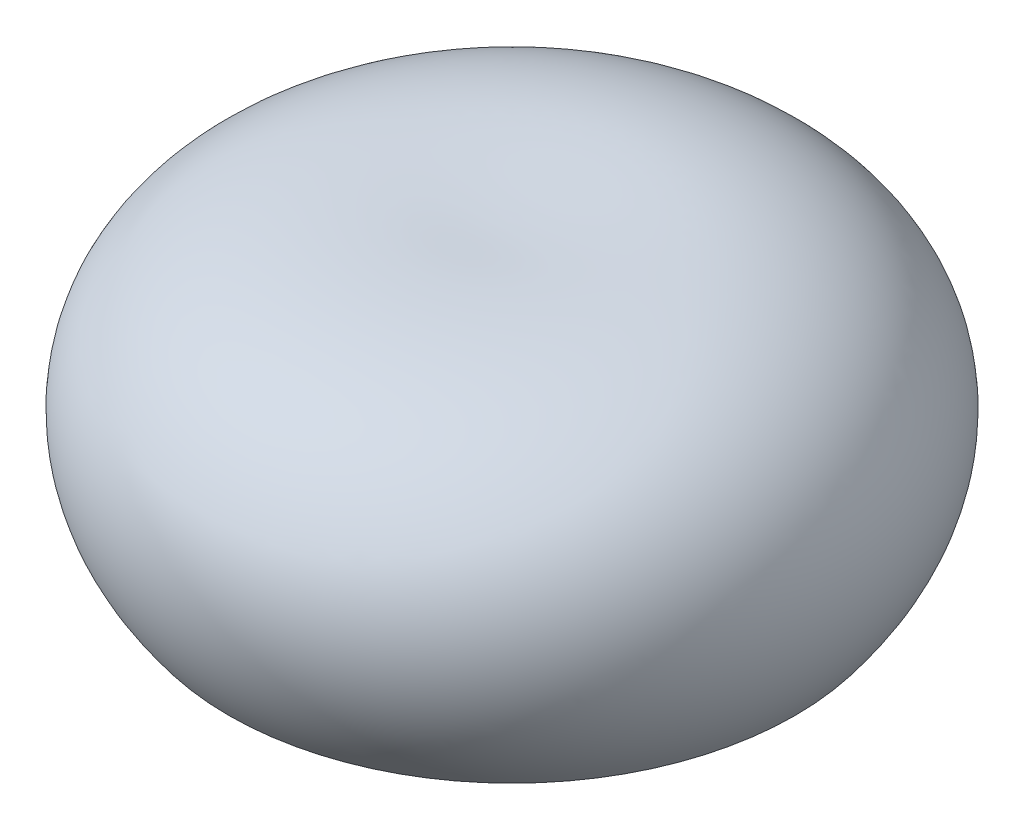
from build123d import *


with BuildPart() as part:
    # 草图1 → 旋转1 (revolve)
    with BuildSketch(Plane.XY):
        with BuildLine():
            Line((0, 7), (0, 0))
            Line((0, 0), (6.831441261, 0))
            add(Edge.make_bspline(
                [(0, 7), (0.073826027, 6.99961248), (0.178309524, 6.999064037), (0.306353289, 7.001245912), (0.380494798, 7.002863842), (0.441570297, 7.004497041), (0.495006805, 7.006121221), (0.543211062, 7.007739734), (0.587527277, 7.009349058), (0.628802834, 7.010947825), (0.667614606, 7.012534752), (0.704377034, 7.01410898), (0.739400045, 7.015669846), (0.772922733, 7.017216861), (0.805134201, 7.018749647), (0.83618711, 7.020267916), (0.866206819, 7.021771443), (0.895297775, 7.023260054), (0.923548095, 7.024733613), (0.951032931, 7.026192009), (0.977816991, 7.027635168), (1.003956462, 7.029063019), (1.029500501, 7.030475521), (1.054492406, 7.031872635), (1.078970545, 7.033254337), (1.10296911, 7.034620614), (1.126518722, 7.035971457), (1.149646932, 7.037306863), (1.172378634, 7.038626836), (1.194736407, 7.039931383), (1.216740809, 7.041220517), (1.238410615, 7.042494251), (1.25976303, 7.0437526), (1.280813862, 7.044995589), (1.301577678, 7.046223234), (1.322067936, 7.047435562), (1.342297094, 7.048632594), (1.362276717, 7.049814357), (1.382017559, 7.050980881), (1.401529643, 7.052132189), (1.420822325, 7.053268312), (1.439904357, 7.054389279), (1.458783938, 7.055495119), (1.477468763, 7.056585861), (1.495966064, 7.057661539), (1.514282646, 7.058722181), (1.532424926, 7.059767819), (1.550398957, 7.060798482), (1.568210462, 7.061814207), (1.585864853, 7.062815017), (1.603367259, 7.063800952), (1.62072254, 7.064772037), (1.637935314, 7.065728308), (1.655009966, 7.066669794), (1.671950667, 7.067596524), (1.68876139, 7.068508536), (1.705445919, 7.069405855), (1.722007866, 7.070288514), (1.738450677, 7.071156547), (1.754777643, 7.072009978), (1.770991912, 7.072848845), (1.787096497, 7.073673172), (1.803094282, 7.074482995), (1.81898803, 7.075278339), (1.834780391, 7.076059237), (1.850473907, 7.076825718), (1.86607102, 7.077577811), (1.881574075, 7.078315544), (1.896985327, 7.079038948), (1.912306943, 7.07974805), (1.927541011, 7.080442881), (1.94268954, 7.081123467), (1.957754466, 7.081789835), (1.972737654, 7.082442017), (1.987640906, 7.083080038), (2.002465956, 7.083703922), (2.017214482, 7.084313704), (2.031888102, 7.084909403), (2.046488381, 7.085491048), (2.06101683, 7.086058669), (2.075474911, 7.086612287), (2.089864039, 7.087151929), (2.104185584, 7.087677622), (2.118440871, 7.088189393), (2.132631183, 7.088687262), (2.146757765, 7.089171256), (2.160821822, 7.089641403), (2.174824525, 7.090097722), (2.188767006, 7.09054024), (2.202650367, 7.09096898), (2.216475676, 7.091383966), (2.23024397, 7.091785222), (2.243956256, 7.092172768), (2.257613513, 7.092546632), (2.271216693, 7.092906831), (2.284766719, 7.093253391), (2.298264492, 7.093586334), (2.311710885, 7.09390568), (2.32510675, 7.094211452), (2.338452915, 7.094503671), (2.351750186, 7.094782357), (2.364999348, 7.095047533), (2.378201166, 7.09529922), (2.391356385, 7.095537436), (2.404465731, 7.095762203), (2.417529911, 7.09597354), (2.430549615, 7.096171469), (2.443525516, 7.096356007), (2.45645827, 7.096527175), (2.469348518, 7.09668499), (2.482196883, 7.096829475), (2.495003975, 7.096960644), (2.50777039, 7.097078519), (2.520496708, 7.097183115), (2.533183498, 7.097274453), (2.545831313, 7.097352551), (2.558440695, 7.097417424), (2.571012173, 7.097469092), (2.583546264, 7.09750757), (2.596043474, 7.097532877), (2.608504298, 7.097545029), (2.620929218, 7.097544042), (2.633318709, 7.097529932), (2.64567323, 7.097502718), (2.657993237, 7.097462414), (2.67027917, 7.097409035), (2.682531464, 7.097342598), (2.694750544, 7.09726312), (2.706936823, 7.097170612), (2.719090708, 7.097065093), (2.731212598, 7.096946574), (2.743302883, 7.096815074), (2.755361945, 7.096670604), (2.767390158, 7.096513182), (2.779387888, 7.096342817), (2.791355496, 7.096159528), (2.803293333, 7.095963325), (2.815201745, 7.095754224), (2.827081071, 7.095532236), (2.838931641, 7.095297379), (2.850753782, 7.095049659), (2.862547814, 7.094789094), (2.874314048, 7.094515696), (2.886052794, 7.094229477), (2.89776435, 7.093930449), (2.909449014, 7.093618625), (2.921107076, 7.093294014), (2.932738821, 7.092956632), (2.944344528, 7.092606489), (2.955924471, 7.092243596), (2.967478921, 7.091867965), (2.979008141, 7.091479607), (2.990512392, 7.091078535), (3.001991929, 7.090664754), (3.013447002, 7.090238283), (3.024877857, 7.089799124), (3.036284736, 7.089347295), (3.047667878, 7.088882802), (3.059027515, 7.088405656), (3.070363877, 7.087915865), (3.081677189, 7.087413443), (3.092967672, 7.086898398), (3.104235546, 7.086370736), (3.115481023, 7.085830472), (3.126704315, 7.085277611), (3.137905628, 7.084712164), (3.149085165, 7.084134138), (3.160243127, 7.083543545), (3.171379711, 7.08294039), (3.18249511, 7.082324685), (3.193589514, 7.081696437), (3.204663111, 7.081055651), (3.215716085, 7.080402341), (3.226748617, 7.079736509), (3.237760886, 7.079058168), (3.248753066, 7.078367321), (3.25972533, 7.077663979), (3.270677849, 7.076948147), (3.28161079, 7.076219835), (3.292524317, 7.075479047), (3.303418592, 7.074725791), (3.314293774, 7.073960076), (3.325150021, 7.073181906), (3.335987487, 7.072391289), (3.346806324, 7.071588229), (3.357606682, 7.070772736), (3.368388709, 7.069944815), (3.379152549, 7.069104471), (3.389898346, 7.068251711), (3.40062624, 7.067386539), (3.411336371, 7.066508962), (3.422028874, 7.065618987), (3.432703885, 7.064716619), (3.443361536, 7.063801859), (3.454001959, 7.062874719), (3.46462528, 7.061935199), (3.475231627, 7.060983306), (3.485821126, 7.060019045), (3.496393899, 7.059042419), (3.506950067, 7.058053435), (3.51748975, 7.057052097), (3.528013066, 7.056038409), (3.53852013, 7.055012375), (3.549011057, 7.053973998), (3.559485961, 7.052923283), (3.569944951, 7.051860236), (3.580388137, 7.050784859), (3.590815628, 7.049697155), (3.60122753, 7.04859713), (3.611623946, 7.047484783), (3.622004982, 7.046360123), (3.632370739, 7.04522315), (3.642721317, 7.044073867), (3.653056816, 7.042912278), (3.663377333, 7.041738386), (3.673682964, 7.040552194), (3.683973805, 7.039353704), (3.694249949, 7.038142919), (3.704511488, 7.036919842), (3.714758514, 7.035684475), (3.724991116, 7.03443682), (3.735209383, 7.033176878), (3.745413403, 7.031904655), (3.75560326, 7.03062015), (3.765779041, 7.029323364), (3.775940829, 7.028014301), (3.786088707, 7.026692964), (3.796222756, 7.025359352), (3.806343057, 7.024013466), (3.816449688, 7.02265531), (3.826542729, 7.021284883), (3.836622256, 7.019902188), (3.846688346, 7.018507226), (3.856741073, 7.017099995), (3.866780512, 7.015680502), (3.876806735, 7.01424874), (3.886819815, 7.012804716), (3.896819824, 7.01134843), (3.90680683, 7.009879879), (3.916780903, 7.008399066), (3.926742113, 7.006905992), (3.936690524, 7.005400655), (3.946626205, 7.003883057), (3.956549222, 7.002353198), (3.966459637, 7.000811077), (3.976357517, 6.999256695), (3.986242922, 6.997690051), (3.996115917, 6.996111144), (4.005976561, 6.994519976), (4.015824916, 6.992916545), (4.02566104, 6.991300851), (4.035484994, 6.989672893), (4.045296834, 6.988032669), (4.055096619, 6.986380181), (4.064884405, 6.984715427), (4.074660248, 6.983038404), (4.084424202, 6.981349114), (4.094176323, 6.979647555), (4.103916663, 6.977933724), (4.113645276, 6.976207622), (4.123362214, 6.974469247), (4.133067528, 6.972718596), (4.142761269, 6.970955668), (4.152443487, 6.969180463), (4.162114232, 6.967392978), (4.171773552, 6.965593212), (4.181421496, 6.963781161), (4.191058111, 6.961956825), (4.200683444, 6.960120203), (4.210297541, 6.958271289), (4.219900448, 6.956410085), (4.229492209, 6.954536586), (4.239072869, 6.95265079), (4.248642473, 6.950752695), (4.258201062, 6.948842299), (4.267748681, 6.946919598), (4.277285369, 6.94498459), (4.286811171, 6.943037272), (4.296326125, 6.941077643), (4.305830272, 6.939105696), (4.315323653, 6.937121433), (4.324806306, 6.935124847), (4.334278271, 6.933115936), (4.343739584, 6.931094697), (4.353190285, 6.929061127), (4.36263041, 6.927015222), (4.372059995, 6.924956978), (4.381479078, 6.922886393), (4.390887692, 6.920803462), (4.400285874, 6.918708182), (4.409673658, 6.916600549), (4.419051079, 6.914480559), (4.42841817, 6.912348208), (4.437774964, 6.910203491), (4.447121494, 6.908046408), (4.456457791, 6.905876949), (4.465783889, 6.903695116), (4.475099817, 6.901500898), (4.484405608, 6.899294297), (4.493701291, 6.897075303), (4.502986897, 6.894843915), (4.512262455, 6.892600126), (4.521527995, 6.890343936), (4.530783544, 6.888075334), (4.540029131, 6.885794319), (4.549264784, 6.883500886), (4.55849053, 6.881195028), (4.567706398, 6.878876743), (4.576912412, 6.876546022), (4.5861086, 6.874202864), (4.595294987, 6.871847261), (4.604471599, 6.869479209), (4.61363846, 6.8670987), (4.622795596, 6.864705731), (4.63194303, 6.862300299), (4.641080787, 6.859882391), (4.65020889, 6.85745201), (4.659327362, 6.855009142), (4.668436227, 6.852553788), (4.677535505, 6.850085939), (4.686625221, 6.847605588), (4.695705394, 6.845112732), (4.704776047, 6.842607362), (4.713837201, 6.840089474), (4.722888876, 6.83755906), (4.731931092, 6.835016114), (4.740963871, 6.832460632), (4.74998723, 6.829892604), (4.75900119, 6.827312027), (4.768005769, 6.824718891), (4.777000986, 6.822113193), (4.785986859, 6.819494921), (4.794963407, 6.816864075), (4.803930647, 6.814220643), (4.812888596, 6.811564621), (4.821837272, 6.808895998), (4.830776691, 6.806214774), (4.839706869, 6.803520935), (4.848627822, 6.800814476), (4.857539568, 6.798095391), (4.866442119, 6.795363672), (4.875335493, 6.792619313), (4.884219704, 6.789862302), (4.893094767, 6.787092637), (4.901960695, 6.784310306), (4.910817504, 6.781515306), (4.919665205, 6.778707625), (4.928503814, 6.775887257), (4.937333343, 6.773054194), (4.946153805, 6.770208428), (4.954965213, 6.767349953), (4.963767579, 6.764478756), (4.972560915, 6.761594835), (4.981345232, 6.758698176), (4.990120543, 6.755788775), (4.998886858, 6.752866623), (5.007644188, 6.74993171), (5.016392546, 6.746984029), (5.025131939, 6.744023569), (5.033862379, 6.741050326), (5.042583876, 6.738064287), (5.051296439, 6.735065448), (5.060000077, 6.732053794), (5.068694801, 6.729029321), (5.077380618, 6.725992018), (5.086057538, 6.722941878), (5.094725569, 6.71987889), (5.103384718, 6.716803044), (5.112034995, 6.713714334), (5.120676405, 6.710612749), (5.129308958, 6.70749828), (5.137932659, 6.704370916), (5.146547516, 6.701230651), (5.155153537, 6.698077474), (5.163750726, 6.694911373), (5.17233909, 6.691732342), (5.180918636, 6.688540369), (5.189489369, 6.685335446), (5.198051295, 6.682117563), (5.206604418, 6.678886708), (5.215148744, 6.675642873), (5.223684278, 6.672386047), (5.232211025, 6.669116222), (5.240728988, 6.665833385), (5.249238171, 6.662537528), (5.25773858, 6.659228639), (5.266230218, 6.65590671), (5.274713087, 6.652571728), (5.283187193, 6.649223684), (5.291652536, 6.645862568), (5.300109121, 6.642488368), (5.308556949, 6.639101074), (5.316996024, 6.635700677), (5.325426348, 6.632287163), (5.333847922, 6.628860523), (5.342260749, 6.625420747), (5.350664829, 6.62196782), (5.359060165, 6.618501737), (5.367446757, 6.615022483), (5.375824607, 6.611530048), (5.384193715, 6.608024418), (5.392554082, 6.604505586), (5.400905709, 6.60097354), (5.409248594, 6.597428265), (5.417582739, 6.593869754), (5.425908142, 6.590297991), (5.434224804, 6.586712969), (5.442532724, 6.583114673), (5.450831901, 6.579503092), (5.459122334, 6.575878214), (5.467404022, 6.572240029), (5.475676964, 6.568588524), (5.483941157, 6.564923686), (5.492196599, 6.561245503), (5.50044329, 6.557553965), (5.508681226, 6.553849056), (5.516910406, 6.550130769), (5.525130826, 6.546399086), (5.533342485, 6.542653999), (5.541545379, 6.538895494), (5.549739504, 6.535123557), (5.557924857, 6.531338176), (5.566101436, 6.527539342), (5.574269235, 6.523727037), (5.582428252, 6.519901252), (5.590578482, 6.516061971), (5.598719922, 6.512209184), (5.606852565, 6.508342875), (5.61497641, 6.504463035), (5.623091449, 6.500569647), (5.631197678, 6.496662699), (5.639295091, 6.492742179), (5.647383684, 6.488808072), (5.655463452, 6.484860367), (5.663534387, 6.480899047), (5.671596486, 6.476924101), (5.679649739, 6.472935514), (5.687694144, 6.468933274), (5.695729692, 6.464917367), (5.703756377, 6.460887777), (5.711774192, 6.456844492), (5.71978313, 6.452787497), (5.727783185, 6.44871678), (5.735774348, 6.444632324), (5.743756613, 6.440534118), (5.751729971, 6.436422145), (5.759694415, 6.432296392), (5.767649937, 6.428156845), (5.775596528, 6.424003489), (5.783534181, 6.41983631), (5.791462886, 6.415655292), (5.799382636, 6.411460423), (5.807293419, 6.407251684), (5.81519523, 6.403029064), (5.823088058, 6.398792549), (5.830971892, 6.394542118), (5.838846725, 6.390277764), (5.846712546, 6.385999466), (5.854569345, 6.381707212), (5.862417112, 6.377400984), (5.870255837, 6.37308077), (5.878085509, 6.368746552), (5.885906118, 6.364398316), (5.893717654, 6.360036046), (5.901520105, 6.355659726), (5.90931346, 6.351269342), (5.917097708, 6.346864875), (5.924872839, 6.342446315), (5.932638837, 6.338013638), (5.940395695, 6.333566835), (5.948143398, 6.329105888), (5.955881936, 6.324630778), (5.963611296, 6.320141494), (5.971331465, 6.315638016), (5.97904243, 6.311120327), (5.98674418, 6.306588415), (5.994436701, 6.302042259), (6.002119979, 6.297481844), (6.009794004, 6.292907155), (6.017458758, 6.288318172), (6.02511423, 6.283714882), (6.032760407, 6.279097266), (6.040397273, 6.274465306), (6.048024816, 6.269818988), (6.05564302, 6.265158293), (6.06325187, 6.260483203), (6.070851354, 6.255793703), (6.078441456, 6.251089774), (6.08602216, 6.246371399), (6.093593452, 6.241638561), (6.101155317, 6.236891242), (6.108707739, 6.232129424), (6.116250702, 6.22735309), (6.123784191, 6.222562222), (6.13130819, 6.217756803), (6.138822681, 6.212936811), (6.146327653, 6.208102235), (6.153823082, 6.203253049), (6.161308958, 6.198389242), (6.16878526, 6.19351079), (6.176251974, 6.188617678), (6.183709081, 6.183709887), (6.191156565, 6.178787397), (6.198594407, 6.173850191), (6.206022591, 6.168898249), (6.213441098, 6.163931553), (6.220849911, 6.158950084), (6.228249012, 6.153953824), (6.235638381, 6.148942751), (6.243018001, 6.143916849), (6.250387854, 6.138876098), (6.25774792, 6.133820477), (6.26509818, 6.128749968), (6.272438616, 6.123664551), (6.279769208, 6.118564209), (6.287089935, 6.113448917), (6.294400781, 6.10831866), (6.301701724, 6.103173416), (6.308992744, 6.098013165), (6.316273821, 6.092837888), (6.323544934, 6.087647564), (6.330806063, 6.082442172), (6.33805719, 6.077221696), (6.345298289, 6.071986108), (6.352529345, 6.066735396), (6.359750331, 6.061469533), (6.36696123, 6.056188501), (6.374162017, 6.050892278), (6.381352675, 6.045580846), (6.388533176, 6.040254179), (6.395703504, 6.034912262), (6.402863633, 6.029555069), (6.410013542, 6.024182581), (6.417153208, 6.018794776), (6.424282608, 6.013391631), (6.431401721, 6.007973128), (6.438510521, 6.002539242), (6.445608988, 5.997089955), (6.452697094, 5.991625239), (6.459774821, 5.98614508), (6.466842141, 5.980649449), (6.473899031, 5.975138327), (6.480945468, 5.969611692), (6.487981427, 5.964069521), (6.495006884, 5.95851179), (6.502021813, 5.95293848), (6.50902619, 5.947349564), (6.51601999, 5.941745023), (6.523003188, 5.936124831), (6.529975758, 5.930488968), (6.536937674, 5.924837409), (6.543888912, 5.91917013), (6.550829444, 5.91348711), (6.557759247, 5.907788324), (6.56467829, 5.902073748), (6.57158655, 5.896343361), (6.578483999, 5.890597136), (6.585370611, 5.884835051), (6.592246357, 5.879057081), (6.599111213, 5.873263203), (6.605965148, 5.867453391), (6.612808137, 5.861627622), (6.619640151, 5.855785872), (6.626461162, 5.849928114), (6.633271142, 5.844054327), (6.640070062, 5.838164483), (6.646857895, 5.832258559), (6.65363461, 5.826336527), (6.66040018, 5.820398366), (6.667154576, 5.814444048), (6.673897766, 5.808473547), (6.680629723, 5.802486841), (6.687350415, 5.7964839), (6.694059815, 5.790464702), (6.700757891, 5.784429218), (6.707444612, 5.778377424), (6.714119949, 5.772309292), (6.72078387, 5.766224797), (6.727436346, 5.760123913), (6.734077343, 5.754006611), (6.740706832, 5.747872867), (6.747324779, 5.741722653), (6.753931155, 5.735555942), (6.760525926, 5.729372706), (6.767109061, 5.72317292), (6.773680527, 5.716956554), (6.780240291, 5.710723583), (6.786788322, 5.704473979), (6.793324585, 5.698207711), (6.799849047, 5.691924755), (6.806361676, 5.685625081), (6.812862436, 5.679308661), (6.819351296, 5.672975467), (6.82582822, 5.66662547), (6.832293173, 5.660258641), (6.838746122, 5.653874952), (6.845187032, 5.647474375), (6.851615868, 5.641056878), (6.858032594, 5.634622434), (6.864437176, 5.628171013), (6.870829578, 5.621702586), (6.877209762, 5.615217122), (6.883577694, 5.608714591), (6.889933338, 5.602194965), (6.896276656, 5.595658212), (6.902607613, 5.589104304), (6.908926169, 5.582533207), (6.915232291, 5.575944892), (6.921525938, 5.569339329), (6.927807074, 5.562716486), (6.93407566, 5.556076332), (6.940331659, 5.549418835), (6.946575032, 5.542743965), (6.95280574, 5.536051689), (6.959023744, 5.529341976), (6.965229006, 5.522614794), (6.971421487, 5.515870111), (6.977601144, 5.509107892), (6.983767942, 5.502328109), (6.989921836, 5.495530725), (6.996062789, 5.488715709), (7.00219076, 5.481883029), (7.008305706, 5.47503265), (7.014407587, 5.468164539), (7.020496364, 5.461278663), (7.026571991, 5.454374986), (7.03263443, 5.447453477), (7.038683638, 5.440514101), (7.04471957, 5.433556822), (7.050742184, 5.426581606), (7.056751441, 5.41958842), (7.062747294, 5.412577226), (7.0687297, 5.405547991), (7.074698615, 5.398500679), (7.080653997, 5.391435254), (7.086595799, 5.384351681), (7.092523978, 5.377249924), (7.09843849, 5.370129945), (7.104339288, 5.36299171), (7.110226328, 5.355835181), (7.116099562, 5.348660321), (7.121958947, 5.341467093), (7.127804434, 5.33425546), (7.133635978, 5.327025384), (7.139453534, 5.319776829), (7.145257051, 5.312509755), (7.151046484, 5.305224124), (7.156821783, 5.297919898), (7.162582904, 5.29059704), (7.168329793, 5.283255507), (7.174062407, 5.275895265), (7.179780693, 5.268516269), (7.185484603, 5.261118484), (7.19117409, 5.253701868), (7.196849099, 5.246266381), (7.202509584, 5.238811984), (7.208155493, 5.231338634), (7.213786775, 5.223846292), (7.219403379, 5.216334916), (7.225005254, 5.208804466), (7.230592346, 5.201254898), (7.236164607, 5.193686173), (7.24172198, 5.186098246), (7.247264415, 5.178491076), (7.252791858, 5.17086462), (7.258304256, 5.163218835), (7.263801554, 5.155553678), (7.269283698, 5.147869105), (7.274750635, 5.140165073), (7.280202309, 5.132441536), (7.285638665, 5.124698453), (7.291059647, 5.116935776), (7.296465199, 5.109153462), (7.301855266, 5.101351464), (7.307229789, 5.093529737), (7.312588712, 5.085688236), (7.31793198, 5.077826914), (7.323259529, 5.069945724), (7.328571308, 5.062044622), (7.333867255, 5.054123557), (7.339147311, 5.046182484), (7.344411415, 5.038221353), (7.349659511, 5.03024012), (7.354891536, 5.022238732), (7.360107432, 5.014217142), (7.365307135, 5.006175301), (7.370490586, 4.99811316), (7.375657723, 4.990030668), (7.380808483, 4.981927776), (7.385942803, 4.973804433), (7.39106062, 4.965660587), (7.396161874, 4.957496189), (7.401246496, 4.949311186), (7.406314425, 4.941105526), (7.411365595, 4.932879156), (7.416399942, 4.924632025), (7.4214174, 4.916364079), (7.426417902, 4.908075264), (7.431401383, 4.899765528), (7.436367773, 4.891434813), (7.441317009, 4.883083068), (7.44624902, 4.874710235), (7.451163738, 4.866316261), (7.456061095, 4.85790109), (7.460941021, 4.849464663), (7.465803446, 4.841006925), (7.470648302, 4.832527819), (7.475475515, 4.824027287), (7.480285016, 4.815505271), (7.485076733, 4.806961712), (7.48985059, 4.79839655), (7.494606521, 4.789809729), (7.499344447, 4.781201186), (7.504064297, 4.772570863), (7.508765993, 4.763918695), (7.513449467, 4.755244626), (7.518114636, 4.74654859), (7.522761429, 4.737830527), (7.527389767, 4.729090373), (7.531999574, 4.720328065), (7.536590772, 4.71154354), (7.541163283, 4.702736733), (7.545717027, 4.693907579), (7.550251926, 4.685056012), (7.5547679, 4.676181967), (7.559264867, 4.667285378), (7.563742748, 4.658366177), (7.568201459, 4.649424296), (7.572640919, 4.640459668), (7.577061042, 4.631472224), (7.581461751, 4.622461894), (7.585842955, 4.613428609), (7.590204571, 4.604372298), (7.594546516, 4.595292891), (7.5988687, 4.586190314), (7.603171038, 4.577064496), (7.607453444, 4.567915364), (7.611715826, 4.558742845), (7.615958098, 4.549546864), (7.620180171, 4.540327347), (7.624381949, 4.531084217), (7.628563348, 4.521817399), (7.632724272, 4.512526815), (7.63686463, 4.503212389), (7.640984331, 4.493874042), (7.645083274, 4.484511694), (7.649161372, 4.475125267), (7.653218524, 4.465714678), (7.657254638, 4.45627985), (7.661269612, 4.446820696), (7.665263355, 4.437337138), (7.66923576, 4.427829089), (7.673186735, 4.418296467), (7.677116175, 4.408739186), (7.68102398, 4.39915716), (7.68491005, 4.389550304), (7.688774278, 4.379918528), (7.692616567, 4.370261746), (7.696436804, 4.360579866), (7.700234889, 4.350872801), (7.704010715, 4.341140458), (7.707764174, 4.331382747), (7.711495158, 4.321599574), (7.715203559, 4.311790846), (7.718889263, 4.301956468), (7.722552163, 4.292096345), (7.726192146, 4.28221038), (7.729809098, 4.272298475), (7.733402908, 4.262360534), (7.736973454, 4.252396454), (7.740520629, 4.242406139), (7.744044308, 4.232389483), (7.747544379, 4.222346387), (7.751020719, 4.212276746), (7.754473208, 4.202180455), (7.757901727, 4.19205741), (7.76130615, 4.181907501), (7.764686357, 4.171730623), (7.76804222, 4.161526665), (7.771373615, 4.151295518), (7.774680415, 4.14103707), (7.77796249, 4.130751209), (7.781219711, 4.120437819), (7.784451948, 4.110096786), (7.787659069, 4.099727995), (7.79084094, 4.089331325), (7.793997427, 4.07890666), (7.797128393, 4.068453878), (7.800233702, 4.057972858), (7.803313213, 4.047463476), (7.80636679, 4.036925609), (7.809394288, 4.02635913), (7.812395566, 4.015763911), (7.815370481, 4.005139825), (7.818318884, 3.99448674), (7.821240631, 3.983804525), (7.824135572, 3.973093046), (7.827003555, 3.962352168), (7.829844432, 3.951581755), (7.832658048, 3.940781669), (7.835444246, 3.929951769), (7.838202873, 3.919091914), (7.84093377, 3.908201962), (7.843636775, 3.897281765), (7.846311728, 3.886331179), (7.848958465, 3.875350054), (7.851576822, 3.86433824), (7.854166632, 3.853295584), (7.856727724, 3.842221932), (7.859259931, 3.831117129), (7.861763079, 3.819981015), (7.864236993, 3.808813431), (7.866681497, 3.797614214), (7.869096413, 3.7863832), (7.87148156, 3.775120223), (7.873836757, 3.763825113), (7.876161817, 3.7524977), (7.878456556, 3.74113781), (7.880720784, 3.729745269), (7.882954312, 3.718319898), (7.885156942, 3.706861517), (7.887328483, 3.695369944), (7.889468735, 3.683844992), (7.891577499, 3.672286475), (7.893654571, 3.660694203), (7.895699747, 3.649067982), (7.897712819, 3.637407617), (7.899693575, 3.625712909), (7.901641805, 3.613983657), (7.903557292, 3.602219657), (7.905439817, 3.590420703), (7.907289162, 3.578586584), (7.9091051, 3.566717086), (7.910887405, 3.554811995), (7.912635851, 3.542871091), (7.914350199, 3.530894151), (7.91603022, 3.51888095), (7.917675669, 3.506831258), (7.91928631, 3.494744842), (7.920861894, 3.482621466), (7.922402172, 3.470460891), (7.923906896, 3.458262873), (7.925375808, 3.446027165), (7.92680865, 3.433753515), (7.928205158, 3.421441669), (7.92956507, 3.409091368), (7.930888111, 3.396702347), (7.93217401, 3.38427434), (7.93342249, 3.371807076), (7.934633269, 3.359300277), (7.935806061, 3.346753663), (7.936940577, 3.33416695), (7.93803652, 3.321539846), (7.939093596, 3.308872058), (7.940111499, 3.296163285), (7.941089923, 3.283413222), (7.942028554, 3.27062156), (7.942927078, 3.257787983), (7.943785171, 3.24491217), (7.944602506, 3.231993794), (7.945378752, 3.219032525), (7.946113571, 3.206028022), (7.946806622, 3.192979944), (7.947457556, 3.179887938), (7.948066016, 3.16675165), (7.948631649, 3.153570715), (7.949154083, 3.140344763), (7.949632952, 3.12707342), (7.950067874, 3.1137563), (7.950458468, 3.100393013), (7.950804339, 3.086983161), (7.951105095, 3.073526339), (7.951360327, 3.060022132), (7.951569625, 3.046470119), (7.951732574, 3.03286987), (7.95184874, 3.019220947), (7.951917698, 3.005522904), (7.951938999, 2.991775283), (7.951912198, 2.97797762), (7.951836834, 2.964129441), (7.951712443, 2.950230261), (7.951538547, 2.936279586), (7.951314664, 2.922276911), (7.951040298, 2.908221721), (7.950714946, 2.894113489), (7.950338097, 2.879951678), (7.949909224, 2.865735739), (7.949427798, 2.851465112), (7.948893271, 2.837139222), (7.948305089, 2.822757483), (7.947662685, 2.808319297), (7.946965479, 2.79382405), (7.946212881, 2.779271115), (7.945404291, 2.764659852), (7.944539088, 2.749989604), (7.943616644, 2.7352597), (7.942636317, 2.720469453), (7.941597449, 2.705618158), (7.940499368, 2.690705095), (7.939341388, 2.675729526), (7.938122804, 2.660690694), (7.936842898, 2.645587824), (7.935500935, 2.63042012), (7.934096162, 2.615186768), (7.932627806, 2.599886933), (7.931095082, 2.584519755), (7.929497177, 2.569084356), (7.927833264, 2.553579833), (7.926102496, 2.538005257), (7.924303998, 2.522359677), (7.922436881, 2.506642114), (7.920500227, 2.490851563), (7.918493099, 2.47498699), (7.91641453, 2.459047331), (7.914263532, 2.443031495), (7.912039084, 2.426938356), (7.909740147, 2.410766757), (7.90736564, 2.394515506), (7.904914466, 2.378183376), (7.902385483, 2.361769102), (7.899777529, 2.345271379), (7.897089394, 2.328688866), (7.894319846, 2.312020174), (7.891467606, 2.295263874), (7.888531363, 2.278418489), (7.885509757, 2.261482494), (7.882401395, 2.244454315), (7.879204834, 2.227332324), (7.875918587, 2.210114836), (7.872541115, 2.192800111), (7.86907083, 2.175386346), (7.865506094, 2.157871675), (7.861845206, 2.140254165), (7.858086412, 2.122531812), (7.854227894, 2.104702538), (7.850267765, 2.086764187), (7.846204078, 2.068714521), (7.842034806, 2.050551215), (7.837757848, 2.032271854), (7.833371027, 2.013873922), (7.828872075, 1.995354807), (7.824258639, 1.976711784), (7.819528268, 1.957942018), (7.814678413, 1.93904255), (7.809706418, 1.920010292), (7.804609514, 1.900842023), (7.79938481, 1.881534374), (7.794029295, 1.862083822), (7.788539812, 1.842486682), (7.782913068, 1.822739092), (7.777145613, 1.802837003), (7.771233831, 1.782776166), (7.765173932, 1.762552117), (7.758961935, 1.742160165), (7.752593661, 1.721595371), (7.746064711, 1.70085253), (7.73937045, 1.679926154), (7.732505999, 1.658810446), (7.725466197, 1.637499277), (7.718245598, 1.61598616), (7.710838434, 1.594264216), (7.70323859, 1.572326145), (7.695439582, 1.550164183), (7.68743451, 1.527770068), (7.679216032, 1.505134986), (7.670776315, 1.482249523), (7.662106992, 1.459103603), (7.653199103, 1.435686425), (7.644043042, 1.411986383), (7.634628477, 1.387990983), (7.624944284, 1.363686743), (7.614978446, 1.33905908), (7.604717954, 1.314092184), (7.594148689, 1.28876886), (7.583255271, 1.263070361), (7.572020914, 1.236976177), (7.560427217, 1.210463798), (7.548453948, 1.18350843), (7.536078766, 1.156082653), (7.52327691, 1.128156017), (7.510020795, 1.099694549), (7.496279544, 1.070660156), (7.482018409, 1.041009885), (7.467198033, 1.010695011), (7.451773557, 0.979659882), (7.43569345, 0.947840457), (7.418898027, 0.915162416), (7.401317504, 0.88153868), (7.382869392, 0.846866107), (7.363454982, 0.811020992), (7.342954436, 0.773852795), (7.321219775, 0.735175152), (7.298064541, 0.694752576), (7.273247917, 0.652279979), (7.246449153, 0.607349576), (7.217223809, 0.559393937), (7.184922391, 0.507579711), (7.148521469, 0.450584621), (7.106203239, 0.386040398), (7.053928975, 0.3085951), (6.962588145, 0.177853211), (6.88558457, 0.073425773), (6.831441261, 0)],
                knots=[0, 0, 0, 0, 0.016508251, 0.023363574, 0.028636216, 0.033091617, 0.037025983, 0.04059109, 0.04387702, 0.046942414, 0.049827967, 0.052563282, 0.055170689, 0.057667517, 0.060067538, 0.062381906, 0.064619804, 0.066788902, 0.068895681, 0.070945675, 0.072943656, 0.07489377, 0.076799649, 0.078664492, 0.080491139, 0.082282118, 0.084039697, 0.085765916, 0.087462619, 0.08913148, 0.090774023, 0.092391639, 0.093985605, 0.095557094, 0.097107186, 0.09863688, 0.1001471, 0.101638706, 0.103112495, 0.104569211, 0.10600955, 0.107434162, 0.108843656, 0.110238603, 0.111619541, 0.112986976, 0.114341384, 0.115683217, 0.117012898, 0.118330831, 0.119637397, 0.120932958, 0.122217857, 0.123492421, 0.12475696, 0.126011769, 0.127257131, 0.128493315, 0.129720577, 0.130939162, 0.132149305, 0.13335123, 0.134545153, 0.13573128, 0.136909808, 0.138080926, 0.139244818, 0.140401657, 0.141551613, 0.142694847, 0.143831516, 0.144961768, 0.14608575, 0.1472036, 0.148315453, 0.14942144, 0.150521684, 0.151616309, 0.15270543, 0.153789161, 0.154867612, 0.155940888, 0.157009093, 0.158072325, 0.159130682, 0.160184256, 0.161233138, 0.162277417, 0.163317176, 0.1643525, 0.165383468, 0.166410158, 0.167432647, 0.168451008, 0.169465312, 0.17047563, 0.17148203, 0.172484577, 0.173483335, 0.174478368, 0.175469736, 0.176457499, 0.177441714, 0.178422438, 0.179399726, 0.180373632, 0.181344207, 0.182311504, 0.183275571, 0.184236458, 0.185194213, 0.18614888, 0.187100506, 0.188049136, 0.188994811, 0.189937576, 0.19087747, 0.191814535, 0.192748809, 0.193680333, 0.194609143, 0.195535276, 0.19645877, 0.197379659, 0.198297978, 0.199213761, 0.200127042, 0.201037853, 0.201946226, 0.202852193, 0.203755784, 0.204657029, 0.205555959, 0.206452602, 0.207346986, 0.208239139, 0.209129089, 0.210016863, 0.210902486, 0.211785985, 0.212667385, 0.213546711, 0.214423987, 0.215299238, 0.216172487, 0.217043757, 0.217913071, 0.218780451, 0.219645919, 0.220509497, 0.221371207, 0.222231068, 0.223089102, 0.223945328, 0.224799767, 0.225652438, 0.22650336, 0.227352552, 0.228200033, 0.22904582, 0.229889932, 0.230732387, 0.231573202, 0.232412394, 0.23324998, 0.234085976, 0.234920399, 0.235753266, 0.236584591, 0.237414391, 0.23824268, 0.239069475, 0.23989479, 0.240718639, 0.241541037, 0.242361999, 0.243181539, 0.24399967, 0.244816406, 0.245631761, 0.246445748, 0.247258379, 0.248069669, 0.248879629, 0.249688273, 0.250495612, 0.251301659, 0.252106427, 0.252909926, 0.253712168, 0.254513166, 0.255312931, 0.256111473, 0.256908805, 0.257704937, 0.25849988, 0.259293644, 0.260086241, 0.26087768, 0.261667972, 0.262457128, 0.263245156, 0.264032068, 0.264817873, 0.265602581, 0.266386201, 0.267168742, 0.267950215, 0.268730627, 0.26950999, 0.27028831, 0.271065598, 0.271841862, 0.272617111, 0.273391353, 0.274164597, 0.274936852, 0.275708125, 0.276478425, 0.277247759, 0.278016137, 0.278783566, 0.279550053, 0.280315607, 0.281080235, 0.281843945, 0.282606744, 0.283368639, 0.284129639, 0.28488975, 0.28564898, 0.286407335, 0.287164823, 0.287921451, 0.288677225, 0.289432153, 0.290186241, 0.290939495, 0.291691923, 0.292443531, 0.293194325, 0.293944313, 0.294693499, 0.295441891, 0.296189495, 0.296936317, 0.297682363, 0.298427639, 0.29917215, 0.299915904, 0.300658906, 0.301401162, 0.302142677, 0.302883457, 0.303623508, 0.304362835, 0.305101445, 0.305839342, 0.306576532, 0.30731302, 0.308048812, 0.308783913, 0.309518328, 0.310252063, 0.310985123, 0.311717512, 0.312449236, 0.3131803, 0.313910709, 0.314640467, 0.31536958, 0.316098053, 0.316825891, 0.317553097, 0.318279677, 0.319005636, 0.319730978, 0.320455708, 0.321179831, 0.32190335, 0.322626271, 0.323348598, 0.324070336, 0.324791488, 0.32551206, 0.326232055, 0.326951478, 0.327670332, 0.328388624, 0.329106355, 0.329823532, 0.330540157, 0.331256236, 0.331971771, 0.332686767, 0.333401229, 0.334115159, 0.334828562, 0.335541443, 0.336253804, 0.33696565, 0.337676984, 0.338387811, 0.339098134, 0.339807957, 0.340517283, 0.341226117, 0.341934462, 0.342642321, 0.343349699, 0.344056599, 0.344763024, 0.345468979, 0.346174466, 0.346879489, 0.347584052, 0.348288158, 0.34899181, 0.349695012, 0.350397768, 0.351100081, 0.351801953, 0.352503389, 0.353204392, 0.353904965, 0.354605111, 0.355304834, 0.356004137, 0.356703023, 0.357401495, 0.358099556, 0.35879721, 0.35949446, 0.360191309, 0.360887759, 0.361583815, 0.362279479, 0.362974754, 0.363669643, 0.36436415, 0.365058277, 0.365752027, 0.366445403, 0.367138409, 0.367831047, 0.36852332, 0.369215231, 0.369906783, 0.370597978, 0.37128882, 0.371979312, 0.372669456, 0.373359255, 0.374048713, 0.374737831, 0.375426612, 0.37611506, 0.376803177, 0.377490966, 0.37817843, 0.378865571, 0.379552391, 0.380238895, 0.380925084, 0.381610961, 0.382296529, 0.38298179, 0.383666747, 0.384351403, 0.385035761, 0.385719822, 0.386403589, 0.387087066, 0.387770254, 0.388453157, 0.389135776, 0.389818115, 0.390500176, 0.391181961, 0.391863473, 0.392544714, 0.393225687, 0.393906395, 0.39458684, 0.395267024, 0.39594695, 0.39662662, 0.397306037, 0.397985203, 0.398664121, 0.399342793, 0.400021221, 0.400699408, 0.401377357, 0.402055069, 0.402732547, 0.403409794, 0.404086811, 0.404763602, 0.405440168, 0.406116513, 0.406792637, 0.407468544, 0.408144236, 0.408819716, 0.409494985, 0.410170046, 0.410844901, 0.411519553, 0.412194003, 0.412868255, 0.41354231, 0.414216171, 0.41488984, 0.415563319, 0.416236611, 0.416909718, 0.417582642, 0.418255385, 0.41892795, 0.419600339, 0.420272553, 0.420944597, 0.42161647, 0.422288177, 0.422959719, 0.423631098, 0.424302316, 0.424973377, 0.425644281, 0.426315032, 0.426985631, 0.42765608, 0.428326383, 0.42899654, 0.429666555, 0.430336429, 0.431006165, 0.431675764, 0.43234523, 0.433014564, 0.433683769, 0.434352845, 0.435021797, 0.435690626, 0.436359334, 0.437027923, 0.437696396, 0.438364755, 0.439033001, 0.439701138, 0.440369167, 0.44103709, 0.44170491, 0.442372628, 0.443040248, 0.443707771, 0.444375199, 0.445042534, 0.445709779, 0.446376936, 0.447044007, 0.447710995, 0.4483779, 0.449044726, 0.449711475, 0.450378149, 0.451044749, 0.451711279, 0.452377741, 0.453044136, 0.453710466, 0.454376735, 0.455042944, 0.455709095, 0.456375191, 0.457041233, 0.457707224, 0.458373167, 0.459039062, 0.459704913, 0.460370722, 0.46103649, 0.461702221, 0.462367916, 0.463033577, 0.463699207, 0.464364808, 0.465030382, 0.465695931, 0.466361458, 0.467026964, 0.467692453, 0.468357925, 0.469023384, 0.469688832, 0.47035427, 0.471019702, 0.471685129, 0.472350554, 0.473015978, 0.473681405, 0.474346836, 0.475012273, 0.47567772, 0.476343178, 0.477008649, 0.477674136, 0.478339641, 0.479005166, 0.479670714, 0.480336286, 0.481001886, 0.481667516, 0.482333177, 0.482998872, 0.483664604, 0.484330375, 0.484996187, 0.485662042, 0.486327943, 0.486993892, 0.487659892, 0.488325944, 0.488992052, 0.489658218, 0.490324443, 0.490990731, 0.491657084, 0.492323504, 0.492989993, 0.493656555, 0.494323191, 0.494989904, 0.495656696, 0.49632357, 0.496990528, 0.497657573, 0.498324707, 0.498991932, 0.499659252, 0.500326668, 0.500994183, 0.5016618, 0.502329521, 0.502997348, 0.503665285, 0.504333333, 0.505001496, 0.505669775, 0.506338174, 0.507006695, 0.50767534, 0.508344112, 0.509013014, 0.509682049, 0.510351218, 0.511020525, 0.511689972, 0.512359562, 0.513029297, 0.513699181, 0.514369215, 0.515039403, 0.515709747, 0.516380251, 0.517050916, 0.517721745, 0.518392742, 0.519063908, 0.519735248, 0.520406763, 0.521078456, 0.52175033, 0.522422388, 0.523094633, 0.523767067, 0.524439694, 0.525112516, 0.525785536, 0.526458757, 0.527132183, 0.527805815, 0.528479657, 0.529153711, 0.529827982, 0.530502471, 0.531177181, 0.531852116, 0.532527279, 0.533202673, 0.5338783, 0.534554164, 0.535230268, 0.535906615, 0.536583208, 0.53726005, 0.537937144, 0.538614493, 0.539292101, 0.539969971, 0.540648106, 0.541326508, 0.542005183, 0.542684131, 0.543363358, 0.544042865, 0.544722657, 0.545402737, 0.546083107, 0.546763772, 0.547444735, 0.548125999, 0.548807567, 0.549489443, 0.55017163, 0.550854132, 0.551536953, 0.552220095, 0.552903562, 0.553587358, 0.554271486, 0.55495595, 0.555640753, 0.5563259, 0.557011393, 0.557697236, 0.558383433, 0.559069988, 0.559756904, 0.560444185, 0.561131835, 0.561819858, 0.562508256, 0.563197035, 0.563886198, 0.564575749, 0.565265692, 0.56595603, 0.566646768, 0.567337909, 0.568029458, 0.568721418, 0.569413794, 0.570106589, 0.570799808, 0.571493455, 0.572187533, 0.572882048, 0.573577002, 0.574272401, 0.574968249, 0.575664549, 0.576361306, 0.577058525, 0.57775621, 0.578454364, 0.579152994, 0.579852102, 0.580551693, 0.581251772, 0.581952344, 0.582653412, 0.583354982, 0.584057058, 0.584759644, 0.585462746, 0.586166368, 0.586870514, 0.58757519, 0.5882804, 0.588986149, 0.589692442, 0.590399283, 0.591106678, 0.591814632, 0.592523149, 0.593232235, 0.593941895, 0.594652133, 0.595362955, 0.596074366, 0.596786371, 0.597498975, 0.598212184, 0.598926003, 0.599640438, 0.600355493, 0.601071174, 0.601787486, 0.602504436, 0.603222028, 0.603940268, 0.604659162, 0.605378715, 0.606098933, 0.606819822, 0.607541388, 0.608263636, 0.608986572, 0.609710203, 0.610434533, 0.61115957, 0.611885319, 0.612611786, 0.613338978, 0.6140669, 0.61479556, 0.615524962, 0.616255114, 0.616986021, 0.617717691, 0.61845013, 0.619183344, 0.619917339, 0.620652124, 0.621387703, 0.622124085, 0.622861275, 0.623599281, 0.624338109, 0.625077767, 0.625818261, 0.626559598, 0.627301787, 0.628044833, 0.628788745, 0.629533529, 0.630279192, 0.631025743, 0.631773189, 0.632521537, 0.633270795, 0.634020971, 0.634772072, 0.635524106, 0.636277082, 0.637031006, 0.637785888, 0.638541735, 0.639298555, 0.640056357, 0.640815149, 0.641574939, 0.642335736, 0.643097548, 0.643860385, 0.644624254, 0.645389164, 0.646155124, 0.646922144, 0.647690232, 0.648459398, 0.649229649, 0.650000997, 0.65077345, 0.651547017, 0.652321708, 0.653097533, 0.653874501, 0.654652623, 0.655431908, 0.656212365, 0.656994006, 0.657776841, 0.658560879, 0.659346131, 0.660132607, 0.660920319, 0.661709277, 0.662499491, 0.663290972, 0.664083733, 0.664877782, 0.665673133, 0.666469796, 0.667267783, 0.668067105, 0.668867774, 0.669669802, 0.670473201, 0.671277983, 0.67208416, 0.672891744, 0.673700749, 0.674511186, 0.675323068, 0.676136408, 0.67695122, 0.677767515, 0.678585309, 0.679404613, 0.680225443, 0.68104781, 0.68187173, 0.682697217, 0.683524283, 0.684352945, 0.685183217, 0.686015112, 0.686848647, 0.687683836, 0.688520694, 0.689359237, 0.690199481, 0.69104144, 0.691885132, 0.692730572, 0.693577776, 0.694426762, 0.695277545, 0.696130143, 0.696984574, 0.697840853, 0.698699, 0.699559031, 0.700420965, 0.70128482, 0.702150614, 0.703018367, 0.703888097, 0.704759824, 0.705633566, 0.706509344, 0.707387177, 0.708267086, 0.709149092, 0.710033215, 0.710919476, 0.711807896, 0.712698498, 0.713591303, 0.714486333, 0.715383612, 0.716283161, 0.717185005, 0.718089166, 0.718995668, 0.719904537, 0.720815795, 0.721729469, 0.722645583, 0.723564164, 0.724485237, 0.725408828, 0.726334966, 0.727263675, 0.728194986, 0.729128925, 0.730065521, 0.731004803, 0.7319468, 0.732891544, 0.733839062, 0.734789388, 0.735742552, 0.736698585, 0.737657521, 0.738619392, 0.739584232, 0.740552074, 0.741522955, 0.742496908, 0.743473969, 0.744454175, 0.745437564, 0.746424172, 0.747414039, 0.748407202, 0.749403704, 0.750403582, 0.75140688, 0.752413639, 0.753423901, 0.754437711, 0.755455113, 0.756476152, 0.757500875, 0.758529328, 0.759561559, 0.760597618, 0.761637555, 0.762681419, 0.763729264, 0.764781142, 0.765837108, 0.766897216, 0.767961524, 0.769030088, 0.770102968, 0.771180223, 0.772261915, 0.773348108, 0.774438865, 0.775534251, 0.776634335, 0.777739184, 0.778848869, 0.779963461, 0.781083035, 0.782207666, 0.783337431, 0.784472409, 0.785612681, 0.786758331, 0.787909442, 0.789066103, 0.790228404, 0.791396435, 0.792570292, 0.793750071, 0.794935871, 0.796127795, 0.797325948, 0.798530437, 0.799741374, 0.800958872, 0.802183049, 0.803414025, 0.804651926, 0.805896879, 0.807149016, 0.808408474, 0.809675392, 0.810949915, 0.812232194, 0.813522381, 0.814820636, 0.816127124, 0.817442016, 0.818765486, 0.820097718, 0.8214389, 0.822789227, 0.824148902, 0.825518134, 0.826897142, 0.828286152, 0.829685398, 0.831095124, 0.832515586, 0.833947046, 0.835389779, 0.836844074, 0.838310228, 0.839788554, 0.841279378, 0.84278304, 0.844299896, 0.84583032, 0.847374703, 0.848933455, 0.850507006, 0.852095808, 0.853700338, 0.855321097, 0.856958612, 0.858613442, 0.860286175, 0.861977436, 0.863687885, 0.865418223, 0.867169194, 0.868941592, 0.87073626, 0.872554101, 0.874396079, 0.876263228, 0.878156657, 0.880077562, 0.88202723, 0.884007054, 0.886018541, 0.888063331, 0.890143212, 0.892260136, 0.894416246, 0.896613899, 0.898855701, 0.901144543, 0.903483648, 0.905876625, 0.908327542, 0.910841004, 0.913422269, 0.916077374, 0.918813316, 0.921638278, 0.924561926, 0.927595825, 0.930754002, 0.934053748, 0.937516794, 0.9411711, 0.945053679, 0.94921533, 0.953729132, 0.958707135, 0.964337724, 0.970987573, 0.979600573, 1, 1, 1, 1], degree=3))
        make_face()
    revolve(axis=Axis((0, 7, 0), (0, -1, 0)))

    # 草图2 → 切除-旋转1 (revolve, cut)
    with BuildSketch(Plane.XZ):
        with BuildLine():
            Line((0, 3), (0, -3))
            ThreePointArc((0, -3), (3, 0), (0, 3))
        make_face()
    revolve(axis=Axis((0, 0, 3), (0, 0, -1)), mode=Mode.SUBTRACT)


solid = part.part
